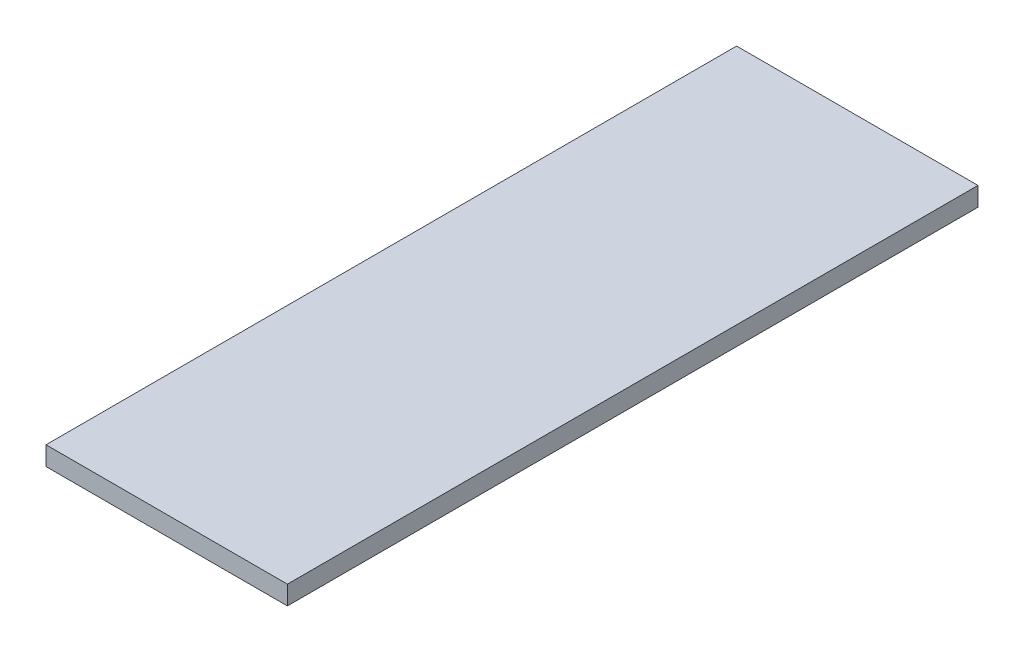
from build123d import *

# Parameters (mm, degrees)
SKETCH1_W           = 230
SKETCH1_H           = 18
BOSS_EXTRUDE1_DEPTH = 650
SKETCH2_W           = 230
SKETCH2_H           = 18
BOSS_EXTRUDE2_DEPTH = 8


with BuildPart() as part:
    # Sketch1 → Boss-Extrude1 (new body)
    with BuildSketch(Plane.XY):
        with Locations((-97, 31.86)):
            Rectangle(SKETCH1_W, SKETCH1_H)
    extrude(amount=-BOSS_EXTRUDE1_DEPTH)

    # Sketch2 → Boss-Extrude2 (add)
    with BuildSketch(Plane(origin=(0, 0, -650), x_dir=(-1, 0, 0), z_dir=(0, 0, -1))):
        with Locations((97, 31.86)):
            Rectangle(SKETCH2_W, SKETCH2_H)
    extrude(amount=BOSS_EXTRUDE2_DEPTH)


solid = part.part
